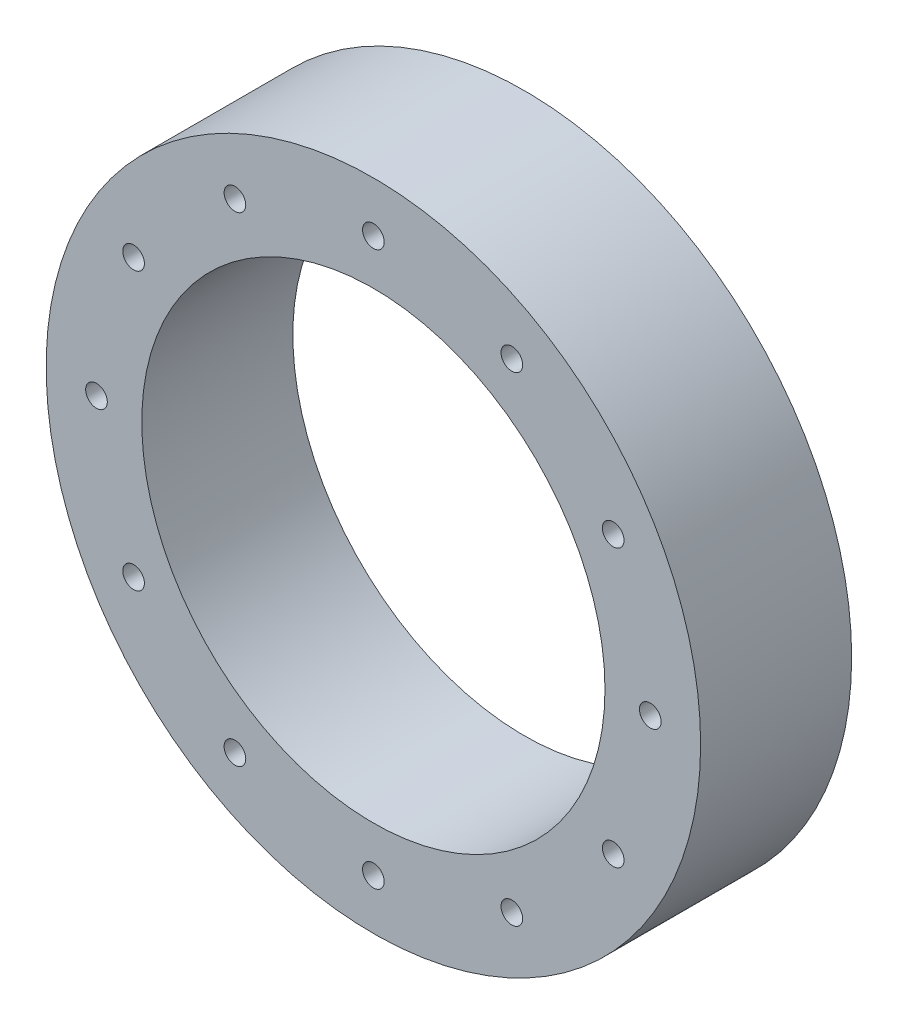
from build123d import *

# Parameters (mm, degrees)
SKETCH_1_R      = 65
SKETCH_1_R_2    = 46
SKETCH_1_R_3    = 2.15
EXTRUDE_1_DEPTH = 30


with BuildPart() as part:
    # 草图1 → 凸台-拉伸1 (new body)
    with BuildSketch(Plane.XY):
        Circle(SKETCH_1_R)
        Circle(SKETCH_1_R_2, mode=Mode.SUBTRACT)
        with Locations((0, 55)):
            Circle(SKETCH_1_R_3, mode=Mode.SUBTRACT)
        with Locations((27.5, 47.631397208)):
            Circle(SKETCH_1_R_3, mode=Mode.SUBTRACT)
        with Locations((47.631397208, 27.5)):
            Circle(SKETCH_1_R_3, mode=Mode.SUBTRACT)
        with Locations((55, 0)):
            Circle(SKETCH_1_R_3, mode=Mode.SUBTRACT)
        with Locations((47.631397208, -27.5)):
            Circle(SKETCH_1_R_3, mode=Mode.SUBTRACT)
        with Locations((27.5, -47.631397208)):
            Circle(SKETCH_1_R_3, mode=Mode.SUBTRACT)
        with Locations((0, -55)):
            Circle(SKETCH_1_R_3, mode=Mode.SUBTRACT)
        with Locations((-27.5, -47.631397208)):
            Circle(SKETCH_1_R_3, mode=Mode.SUBTRACT)
        with Locations((-47.631397208, -27.5)):
            Circle(SKETCH_1_R_3, mode=Mode.SUBTRACT)
        with Locations((-55, 0)):
            Circle(SKETCH_1_R_3, mode=Mode.SUBTRACT)
        with Locations((-47.631397208, 27.5)):
            Circle(SKETCH_1_R_3, mode=Mode.SUBTRACT)
        with Locations((-27.5, 47.631397208)):
            Circle(SKETCH_1_R_3, mode=Mode.SUBTRACT)
    extrude(amount=EXTRUDE_1_DEPTH)


solid = part.part
